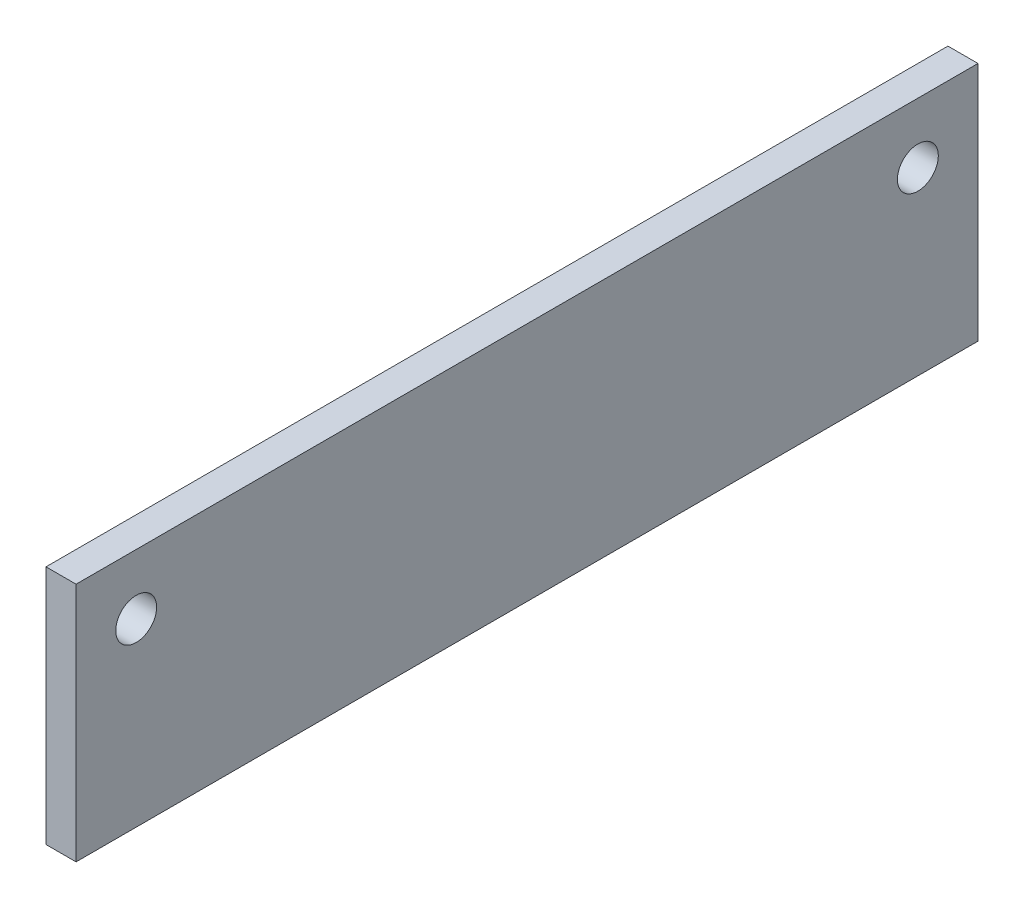
from build123d import *

# Parameters (mm, degrees)
SKETCH1_W           = 75
SKETCH1_H           = 10
BOSS_EXTRUDE1_DEPTH = 2.5


with BuildPart() as part:
    # Sketch1 → Boss-Extrude1 (new body)
    with BuildSketch(Plane(origin=(0, 0, 0), x_dir=(0, 0, -1), z_dir=(1, 0, 0))):
        with BuildLine():
            Line((34.2, 5), (37.5, 5))
            Line((37.5, 5), (37.5, 10))
            Line((37.5, 10), (-37.5, 10))
            Line((-37.5, 10), (-37.5, 5))
            Line((-37.5, 5), (-34.2, 5))
            ThreePointArc((-34.2, 5), (-32.5, 6.7), (-30.8, 5))
            Line((-30.8, 5), (30.8, 5))
            ThreePointArc((30.8, 5), (32.5, 6.7), (34.2, 5))
        make_face()
        with BuildLine():
            Line((-37.5, 0), (37.5, 0))
            Line((37.5, 0), (37.5, 5))
            Line((37.5, 5), (34.2, 5))
            ThreePointArc((34.2, 5), (32.5, 3.3), (30.8, 5))
            Line((30.8, 5), (-30.8, 5))
            ThreePointArc((-30.8, 5), (-32.5, 3.3), (-34.2, 5))
            Line((-34.2, 5), (-37.5, 5))
            Line((-37.5, 5), (-37.5, 0))
        make_face()
        with Locations((0, -5)):
            Rectangle(SKETCH1_W, SKETCH1_H)
    extrude(amount=BOSS_EXTRUDE1_DEPTH)


solid = part.part
